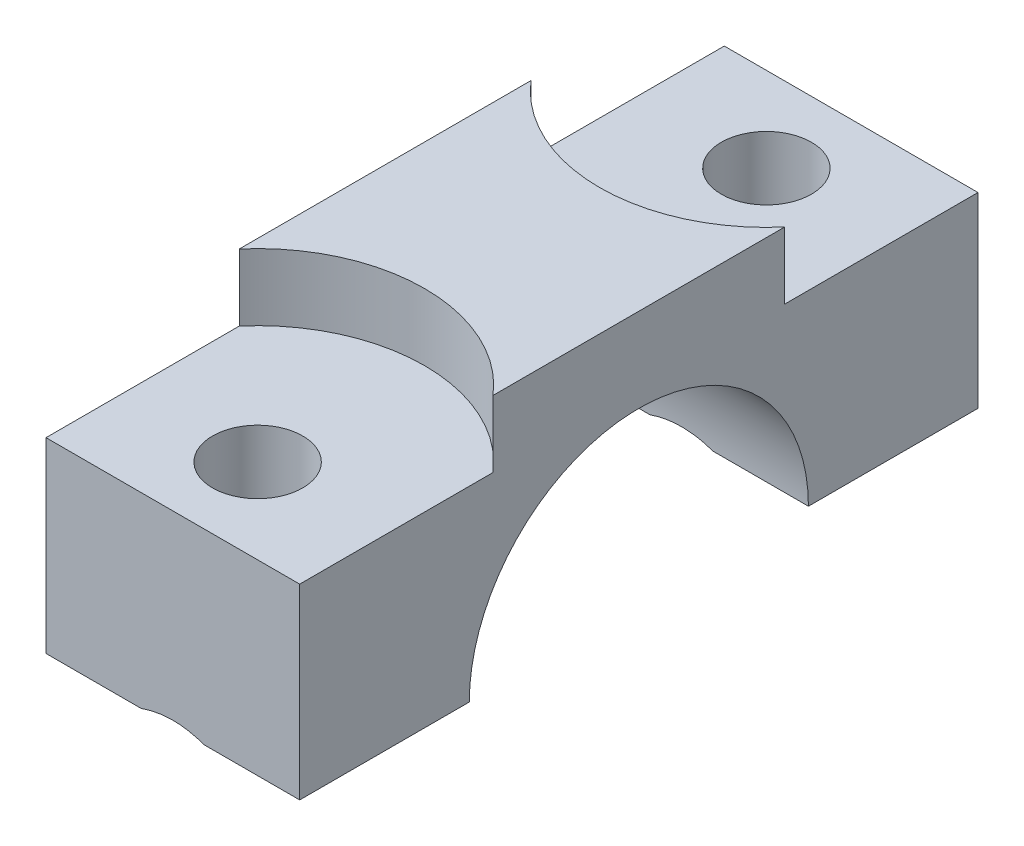
from build123d import *

# Parameters (mm, degrees)
BOSS_EXTRUDE1_DEPTH                          = 9.5
CBORE_FOR_M12_HEX_HEAD_CAP_SCREW2_AT_2_COUNT = 2
CBORE_FOR_M12_HEX_HEAD_CAP_SCREW2_AT_2_PITCH = 38.1


with BuildPart() as part:
    # Sketch1 → Boss-Extrude1 (new, symmetric)
    with BuildSketch(Plane(origin=(0, 0, 0), x_dir=(0, 0, -1), z_dir=(1, 0, 0))):
        with BuildLine():
            Line((25.4, 19), (-25.4, 19))
            Line((-25.4, 19), (-25.4, 0))
            Line((-25.4, 0), (-12.7, 0))
            ThreePointArc((-12.7, 0), (0, 12.7), (12.7, 0))
            Line((12.7, 0), (25.4, 0))
            Line((25.4, 0), (25.4, 19))
        make_face()
    extrude(amount=BOSS_EXTRUDE1_DEPTH, both=True)

    # Sketch8 → CBORE for M12 Hex Head Cap Screw2 (revolve, cut)
    with BuildSketch(Plane(origin=(0, 19, -19.05), x_dir=(0, 0, 1), z_dir=(1, 0, 0))):
        Polygon((0, 0), (0, 19), (6.775, 19), (3.375, 15.6), (3.375, 5), (12.5, 5), (12.5, 0), align=None)
    cbore_for_m12_hex_head_cap_screw2 = revolve(axis=Axis((0, 25.35, -19.05), (0, -1, 0)), mode=Mode.SUBTRACT)

    # CBORE for M12 Hex Head Cap Screw2 at 2: CBORE for M12 Hex Head Cap Screw2 ×2
    with Locations(*[(0, 0, i * CBORE_FOR_M12_HEX_HEAD_CAP_SCREW2_AT_2_PITCH) for i in range(1, CBORE_FOR_M12_HEX_HEAD_CAP_SCREW2_AT_2_COUNT)]):
        add(cbore_for_m12_hex_head_cap_screw2, mode=Mode.SUBTRACT)


solid = part.part
